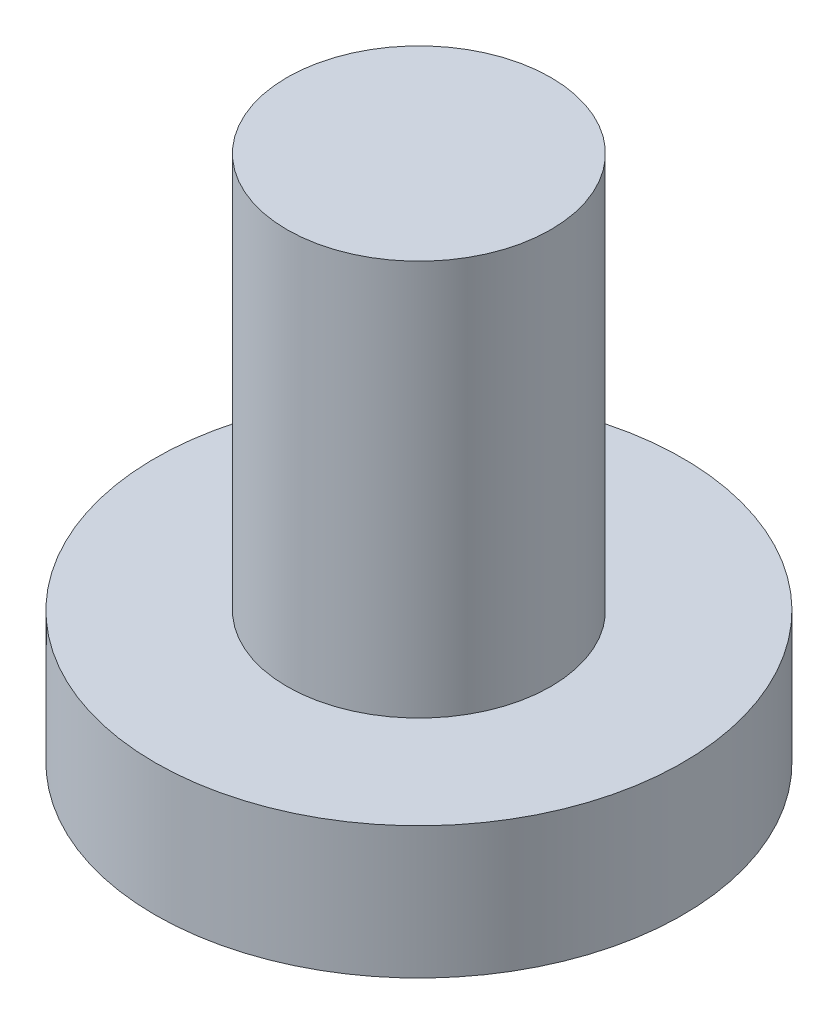
from build123d import *

# Parameters (mm, degrees)
SKETCH1_R           = 4
BOSS_EXTRUDE1_DEPTH = 2
SKETCH2_R           = 2
BOSS_EXTRUDE2_DEPTH = 6


with BuildPart() as part:
    # Sketch1 → Boss-Extrude1 (new body)
    with BuildSketch(Plane(origin=(0, 0, 0), x_dir=(1, 0, 0), z_dir=(0, 1, 0))):
        with Locations(Location((0, 0, 0), (0, 0, 270))):
            Circle(SKETCH1_R)
    extrude(amount=BOSS_EXTRUDE1_DEPTH)

    # Sketch2 → Boss-Extrude2 (add)
    with BuildSketch(Plane(origin=(0, 2, 0), x_dir=(1, 0, 0), z_dir=(0, 1, 0))):
        with Locations(Location((0, 0, 0), (0, 0, 270))):
            Circle(SKETCH2_R)
    extrude(amount=BOSS_EXTRUDE2_DEPTH)


solid = part.part
